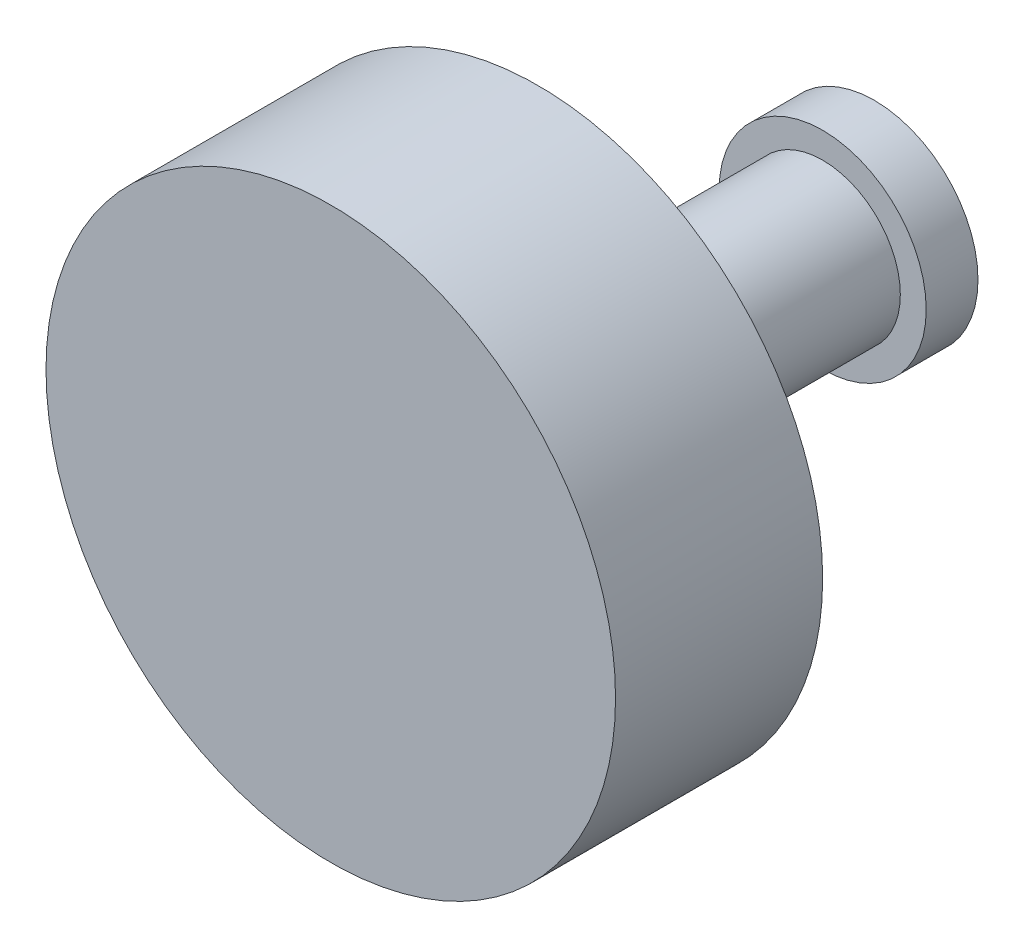
from build123d import *

# Parameters (mm, degrees)
SKETCH_1_R      = 110
EXTRUDE_1_DEPTH = 80
SKETCH_2_R      = 30
EXTRUDE_2_DEPTH = 110
SKETCH_3_R      = 40
EXTRUDE_3_DEPTH = 20
SCALE_1_SCALE   = 0.345


with BuildPart() as part:
    # 草图1 → 凸台-拉伸1 (new body)
    with BuildSketch(Plane.XY):
        Circle(SKETCH_1_R)
    extrude(amount=EXTRUDE_1_DEPTH)

    # 草图2 → 凸台-拉伸2 (add)
    with BuildSketch(Plane(origin=(0, 0, 0), x_dir=(-1, 0, 0), z_dir=(0, 0, -1))):
        with Locations(Location((0, 0, 0), (0, 0, 180))):
            Circle(SKETCH_2_R)
    extrude(amount=EXTRUDE_2_DEPTH)

    # 草图3 → 凸台-拉伸3 (add)
    with BuildSketch(Plane(origin=(0, 0, -110), x_dir=(-1, 0, 0), z_dir=(0, 0, -1))):
        Circle(SKETCH_3_R)
    extrude(amount=EXTRUDE_3_DEPTH)


with BuildPart() as part_1:
    # 缩放比例1: scaled about (0, 0, 0)
    add(part.part.scale(SCALE_1_SCALE))


solid = part_1.part
